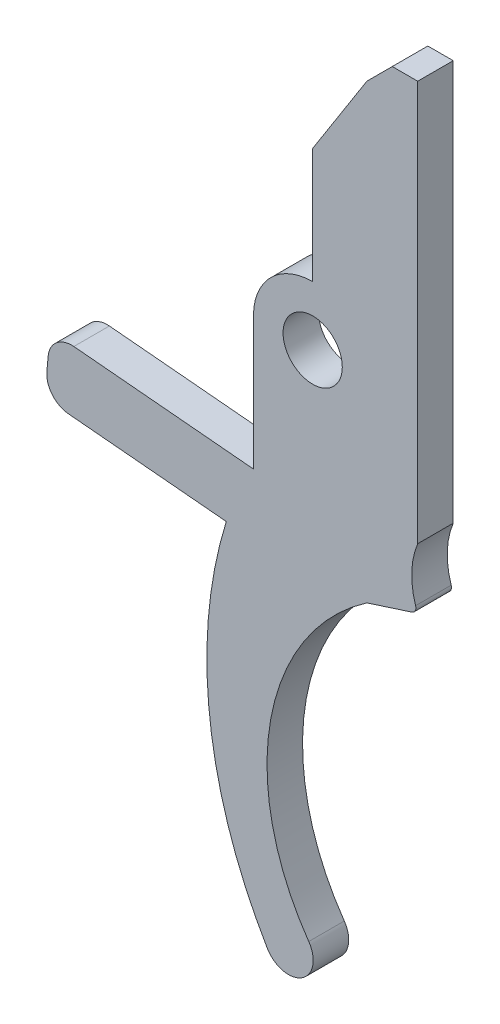
from build123d import *

# Parameters (mm, degrees)
SKETCH_1_R      = 5
SKETCH_1_R_2    = 2.5
EXTRUDE_1_DEPTH = 3


with BuildPart() as part:
    # 스케치1 → 보스-돌출1 (new body)
    # profile 1 of 5: a face of its own
    with BuildSketch(Plane.XY):
        with BuildLine():
            Line((8.866410343, 21.94338903), (4.574998823, 21.94338903))
            Line((4.574998823, 21.94338903), (0, 14.743154306))
            Line((0, 14.743154306), (0, 5))
            ThreePointArc((0, 5), (3.535533906, 3.535533906), (5, 0))
            ThreePointArc((5, 0), (0, -5), (-5, 0))
            Line((-5, 0), (-5, -11.202273073))
            Line((-5, -11.202273073), (-20.162460617, -9.822892201))
            ThreePointArc((-20.162460617, -9.822892201), (-21.623929956, -10.278142815), (-22.335434041, -11.633468491))
            Line((-22.335434041, -11.633468491), (-22.441691139, -12.801470088))
            ThreePointArc((-22.441691139, -12.801470088), (-21.986440525, -14.262939427), (-20.631114849, -14.974443512))
            Line((-20.631114849, -14.974443512), (-7.293133085, -16.187845306))
            ThreePointArc((-7.293133085, -16.187845306), (-8.683000099, -31.29485147), (-3.824169556, -45.666529567))
            ThreePointArc((-3.824169556, -45.666529567), (-0.906566305, -46.354001108), (-0.33095704, -43.412283952))
            ThreePointArc((-0.33095704, -43.412283952), (-3.547402259, -28.784479694), (4.574998823, -16.200967549))
            Line((4.574998823, -16.200967549), (8.3701186, -14.978169718))
            ThreePointArc((8.3701186, -14.978169718), (8.662275884, -14.729272874), (8.69193724, -14.346616734))
            ThreePointArc((8.69193724, -14.346616734), (8.365752146, -12.021808556), (8.866410343, -9.728236855))
            Line((8.866410343, -9.728236855), (8.866410343, 21.94338903))
        make_face()
    # profile 2 of 5: a face of its own
    with BuildSketch(Plane.XY):
        Circle(SKETCH_1_R)
        Circle(SKETCH_1_R_2, mode=Mode.SUBTRACT)
    # profile 3 of 5: a face of its own
    with BuildSketch(Plane.XY):
        with BuildLine():
            ThreePointArc((5, 0), (3.535533906, 3.535533906), (0, 5))
            ThreePointArc((0, 5), (-3.535533906, 3.535533906), (-5, 0))
            ThreePointArc((-5, 0), (0, -5), (5, 0))
        make_face()
        Circle(SKETCH_1_R_2, mode=Mode.SUBTRACT)
    # profile 4 of 5: a face of its own
    with BuildSketch(Plane.XY):
        Polygon((8.866410343, 24.08909479), (6.720704583, 24.08909479), (4.574998823, 21.94338903), (8.866410343, 21.94338903), align=None)
    # profile 5 of 5: a face of its own
    with BuildSketch(Plane.XY):
        with BuildLine():
            Line((8.866410343, 21.94338903), (4.574998823, 21.94338903))
            Line((4.574998823, 21.94338903), (0, 14.743154306))
            Line((0, 14.743154306), (0, 5))
            ThreePointArc((0, 5), (3.535533906, 3.535533906), (5, 0))
            ThreePointArc((5, 0), (0, -5), (-5, 0))
            Line((-5, 0), (-5, -11.202273073))
            Line((-5, -11.202273073), (-20.162460617, -9.822892201))
            ThreePointArc((-20.162460617, -9.822892201), (-21.623929956, -10.278142815), (-22.335434041, -11.633468491))
            Line((-22.335434041, -11.633468491), (-22.441691139, -12.801470088))
            ThreePointArc((-22.441691139, -12.801470088), (-21.986440525, -14.262939427), (-20.631114849, -14.974443512))
            Line((-20.631114849, -14.974443512), (-7.293133085, -16.187845306))
            ThreePointArc((-7.293133085, -16.187845306), (-8.683000099, -31.29485147), (-3.824169556, -45.666529567))
            ThreePointArc((-3.824169556, -45.666529567), (-0.906566305, -46.354001108), (-0.33095704, -43.412283952))
            ThreePointArc((-0.33095704, -43.412283952), (-3.547402259, -28.784479694), (4.574998823, -16.200967549))
            Line((4.574998823, -16.200967549), (8.3701186, -14.978169718))
            ThreePointArc((8.3701186, -14.978169718), (8.662275884, -14.729272874), (8.69193724, -14.346616734))
            ThreePointArc((8.69193724, -14.346616734), (8.365752146, -12.021808556), (8.866410343, -9.728236855))
            Line((8.866410343, -9.728236855), (8.866410343, 21.94338903))
        make_face()
    extrude(amount=EXTRUDE_1_DEPTH)


solid = part.part
